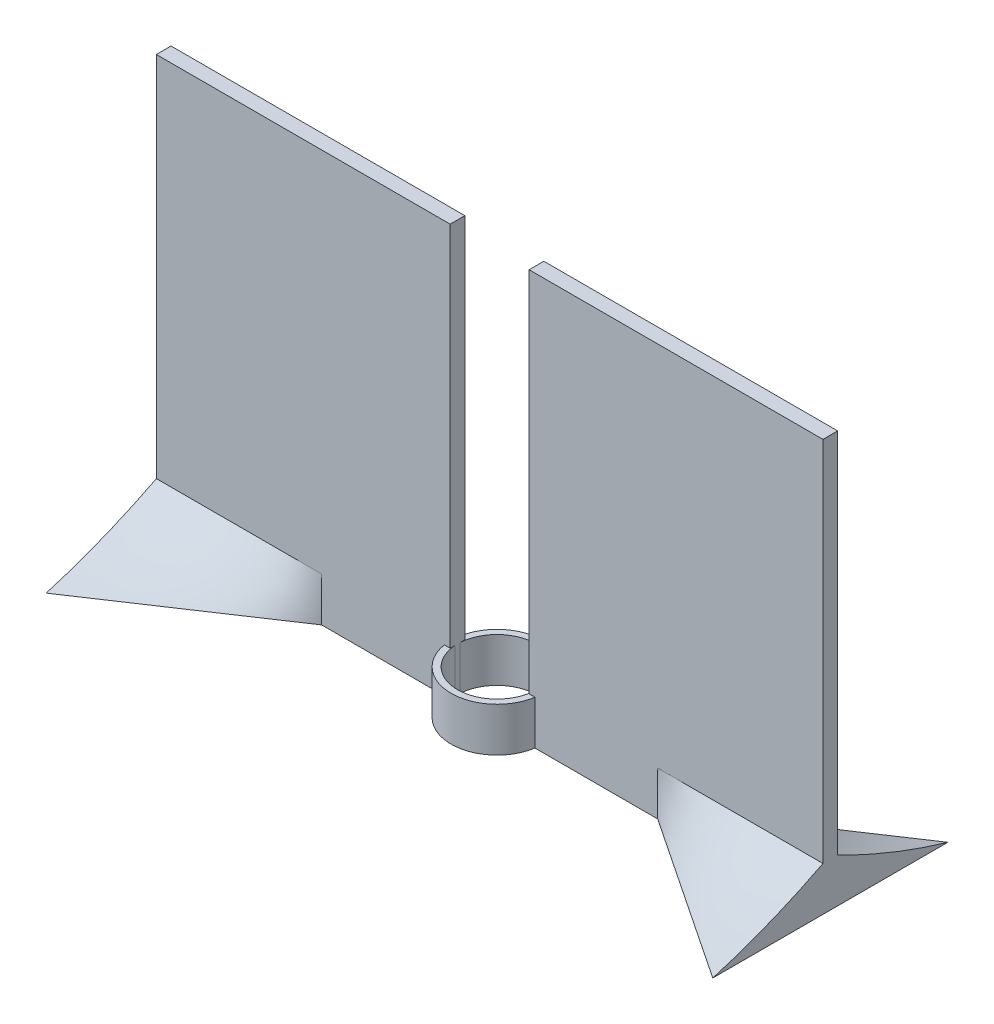
from build123d import *

# Parameters (mm, degrees)
SKETCH1_W           = 4
SKETCH1_H           = 100
BOSS_EXTRUDE1_DEPTH = 80
SKETCH6_W           = 4
SKETCH6_H           = 12
BOSS_EXTRUDE2_DEPTH = 35
SKETCH14_R          = 12.5
SKETCH14_R_2        = 10.775
BOSS_EXTRUDE3_DEPTH = 12


with BuildPart() as part:
    # Sketch1 → Boss-Extrude1 (new body)
    with BuildSketch(Plane(origin=(10.75, 0, 0), x_dir=(0, 0, -1), z_dir=(1, 0, 0))):
        with Locations((0, 62)):
            Rectangle(SKETCH1_W, SKETCH1_H)
    extrude(amount=BOSS_EXTRUDE1_DEPTH)

    # Sketch6 → Boss-Extrude2 (add)
    with BuildSketch(Plane.ZY.offset(-10.75)):
        with Locations((0, 6)):
            Rectangle(SKETCH6_W, SKETCH6_H)
    extrude(amount=-BOSS_EXTRUDE2_DEPTH)

    # Sketch7 → Loft3 section 0
    with BuildSketch(Plane(origin=(45.75, 0, 0), x_dir=(0, 0, -1), z_dir=(1, 0, 0))):
        with BuildLine():
            Line((-2, 12), (2, 12))
            Line((2, 12), (2, 0))
            Line((2, 0), (-2, 0))
            Line((-2, 0), (-2, 12))
        make_face()
    # Sketch5 → Loft3 section 1
    with BuildSketch(Plane(origin=(90.75, 0, 0), x_dir=(0, 0, -1), z_dir=(1, 0, 0))):
        with BuildLine():
            Line((-2, 12), (2, 12))
            add(Edge.make_bspline(
                [(2, 12), (16.438366027, 4.561354626), (32, 0)],
                knots=[0, 0, 0, 1, 1, 1], degree=2))
            Line((32, 0), (-32, 0))
            add(Edge.make_bspline(
                [(-2, 12), (-16.438366027, 4.561354626), (-32, 0)],
                knots=[0, 0, 0, 1, 1, 1], degree=2))
        make_face()
    loft()


with BuildPart() as body_2:
    # Mirror3: mirrored copy
    add(part.part.mirror(Plane(origin=(0, 0, 0), x_dir=(0, 0, 1), z_dir=(1, 0, 0))))


with BuildPart() as part_1:
    add(part.part)

    add(body_2.part)  # Boss-Extrude3 merges body 2
    # Sketch14 → Boss-Extrude3 (add)
    with BuildSketch(Plane(origin=(0, 0, 0), x_dir=(1, 0, 0), z_dir=(0, 1, 0))):
        Circle(SKETCH14_R)
        Circle(SKETCH14_R_2, mode=Mode.SUBTRACT)
    extrude(amount=BOSS_EXTRUDE3_DEPTH)


solid = part_1.part
